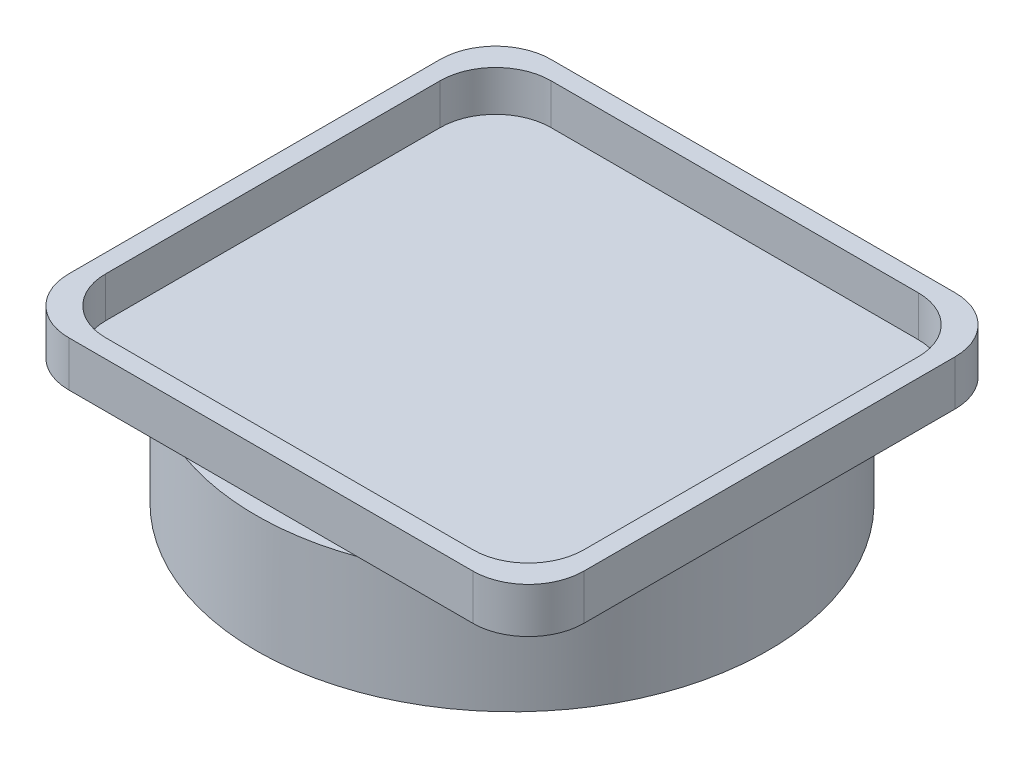
from build123d import *

# Parameters (mm, degrees)
IZIM1_W                     = 27.91
IZIM1_H                     = 26.13
IZIM1_W_2                   = 25.91
IZIM1_H_2                   = 24.13
Y_KSEKLIK_EKSTR_ZYON1_DEPTH = 2.2
RADYUS1_R                   = 3
Y_KSEKLIK_EKSTR_ZYON2_DEPTH = 0.252
IZIM3_R                     = 13.875
Y_KSEKLIK_EKSTR_ZYON3_DEPTH = 6.35


with BuildPart() as part:
    # Çizim1 → Yükseklik-Ekstrüzyon1 (new body)
    with BuildSketch(Plane(origin=(0, 0, 0), x_dir=(1, 0, 0), z_dir=(0, 1, 0))):
        Rectangle(IZIM1_W, IZIM1_H)
        Rectangle(IZIM1_W_2, IZIM1_H_2, mode=Mode.SUBTRACT)
    extrude(amount=Y_KSEKLIK_EKSTR_ZYON1_DEPTH)

    # Radyus1
    radyus1_edges = [part.edges().sort_by_distance(p)[0] for p in [
        (12.955, 1.1, 12.065),
        (12.955, 1.1, -12.065),
        (-12.955, 1.1, -12.065),
        (-12.955, 1.1, 12.065),
        (-13.955, 1.1, -13.065),
        (13.955, 1.1, -13.065),
        (13.955, 1.1, 13.065),
        (-13.955, 1.1, 13.065),
    ]]
    fillet(radyus1_edges, radius=RADYUS1_R)

    # Çizim2 → Yükseklik-Ekstrüzyon2 (add)
    with BuildSketch(Plane.XZ):
        with BuildLine():
            Line((10.955, 13.065), (-10.955, 13.065))
            ThreePointArc((-10.955, 13.065), (-13.076320344, 12.186320344), (-13.955, 10.065))
            Line((-13.955, 10.065), (-13.955, -10.065))
            ThreePointArc((-13.955, -10.065), (-13.076320344, -12.186320344), (-10.955, -13.065))
            Line((-10.955, -13.065), (10.955, -13.065))
            ThreePointArc((10.955, -13.065), (13.076320344, -12.186320344), (13.955, -10.065))
            Line((13.955, -10.065), (13.955, 10.065))
            ThreePointArc((13.955, 10.065), (13.076320344, 12.186320344), (10.955, 13.065))
        make_face()
    extrude(amount=Y_KSEKLIK_EKSTR_ZYON2_DEPTH)

    # Çizim3 → Yükseklik-Ekstrüzyon3 (add)
    with BuildSketch(Plane.XZ.offset(0.252)):
        with Locations(Location((0, 0, 0), (0, 0, 70.325694482))):
            Circle(IZIM3_R)
    extrude(amount=Y_KSEKLIK_EKSTR_ZYON3_DEPTH)


solid = part.part
